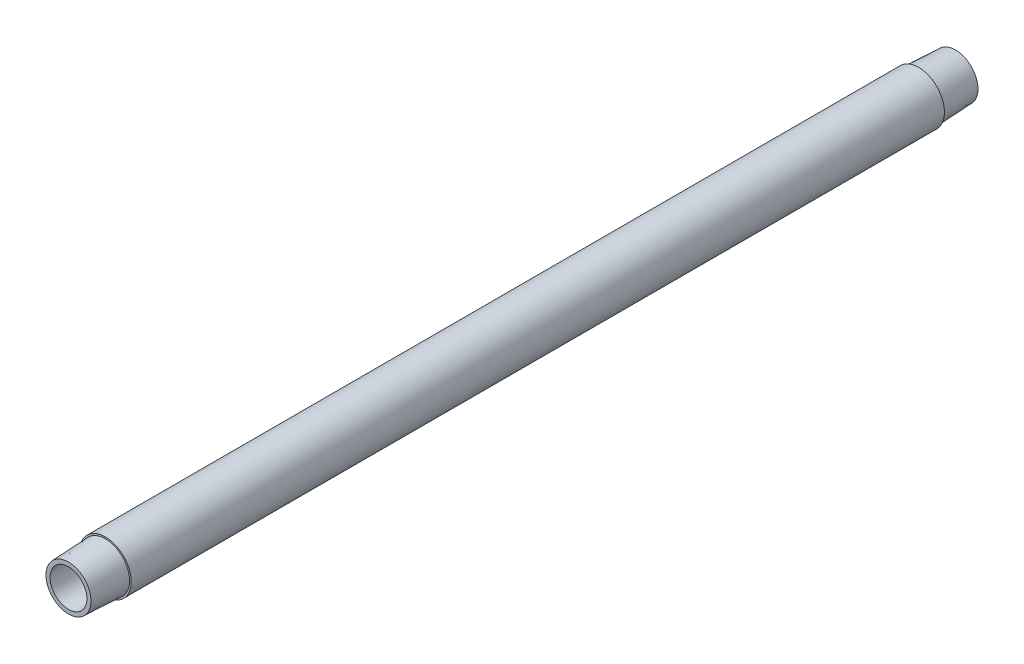
from build123d import *

# Parameters (mm, degrees)
SKETCH1_R           = 13.335
SKETCH1_R_2         = 9.525
BOSS_EXTRUDE1_DEPTH = 457.2


with BuildPart() as part:
    # Sketch1 → Boss-Extrude1 (new body)
    with BuildSketch(Plane.XY):
        Circle(SKETCH1_R)
        Circle(SKETCH1_R_2, mode=Mode.SUBTRACT)
    extrude(amount=BOSS_EXTRUDE1_DEPTH)

    # Sketch2 → Cut-Revolve1 (revolve, cut)
    with BuildSketch(Plane(origin=(0, 0, 0), x_dir=(0, 0, -1), z_dir=(1, 0, 0)), mode=Mode.PRIVATE) as cut_revolve1_sk:
        Polygon((0, 19.581974612), (0, 11.604531919), (-19.007432318, 12.48720106), (-19.007432318, 19.581974612), align=None)
        Polygon((-438.192567682, 19.581974612), (-457.2, 19.581974612), (-457.2, 11.604531919), (-438.192567682, 12.48720106), align=None)
    revolve(cut_revolve1_sk.sketch.rotate(Axis((0, 0, 457.2), (0, 0, -1)), 90), axis=Axis((0, 0, 457.2), (0, 0, -1)), mode=Mode.SUBTRACT)


solid = part.part
